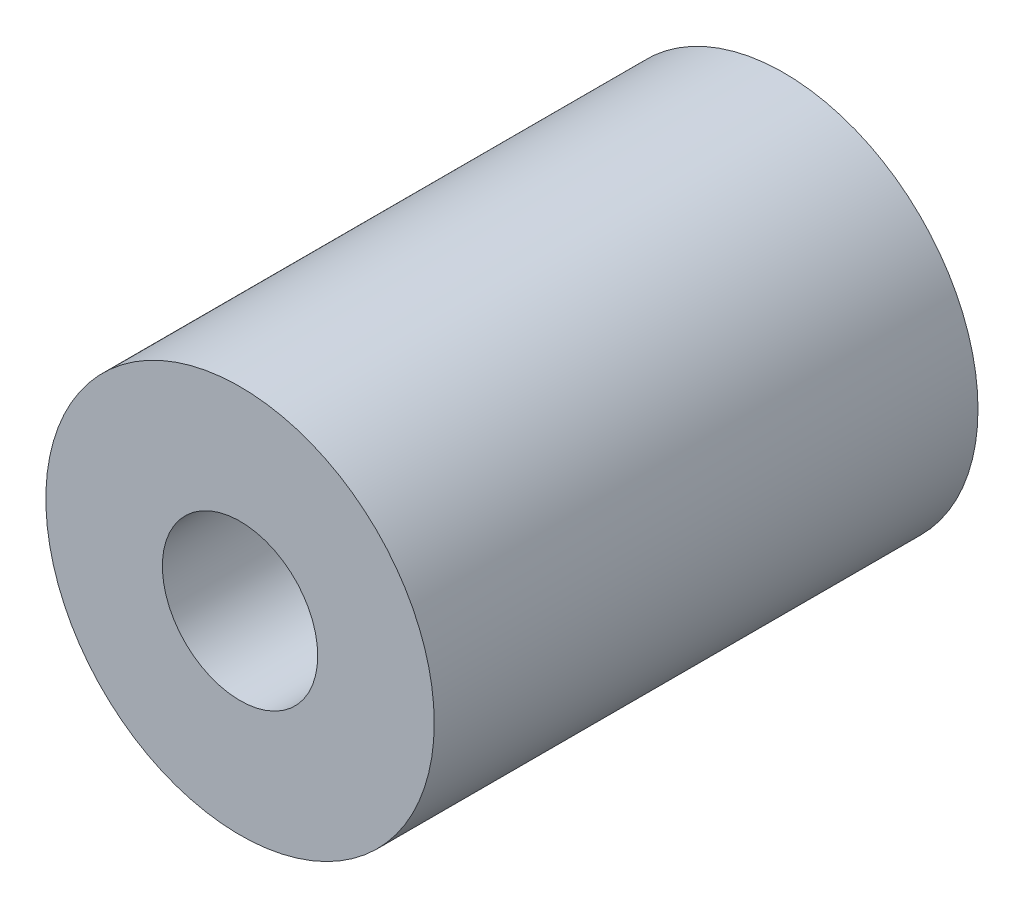
from build123d import *

# Parameters (mm, degrees)
SKETCH1_R           = 5
SKETCH1_R_2         = 2
BOSS_EXTRUDE1_DEPTH = 7


with BuildPart() as part:
    # Sketch1 → Boss-Extrude1 (new, symmetric)
    with BuildSketch(Plane.XY):
        Circle(SKETCH1_R)
        Circle(SKETCH1_R_2, mode=Mode.SUBTRACT)
    extrude(amount=BOSS_EXTRUDE1_DEPTH, both=True)


solid = part.part
